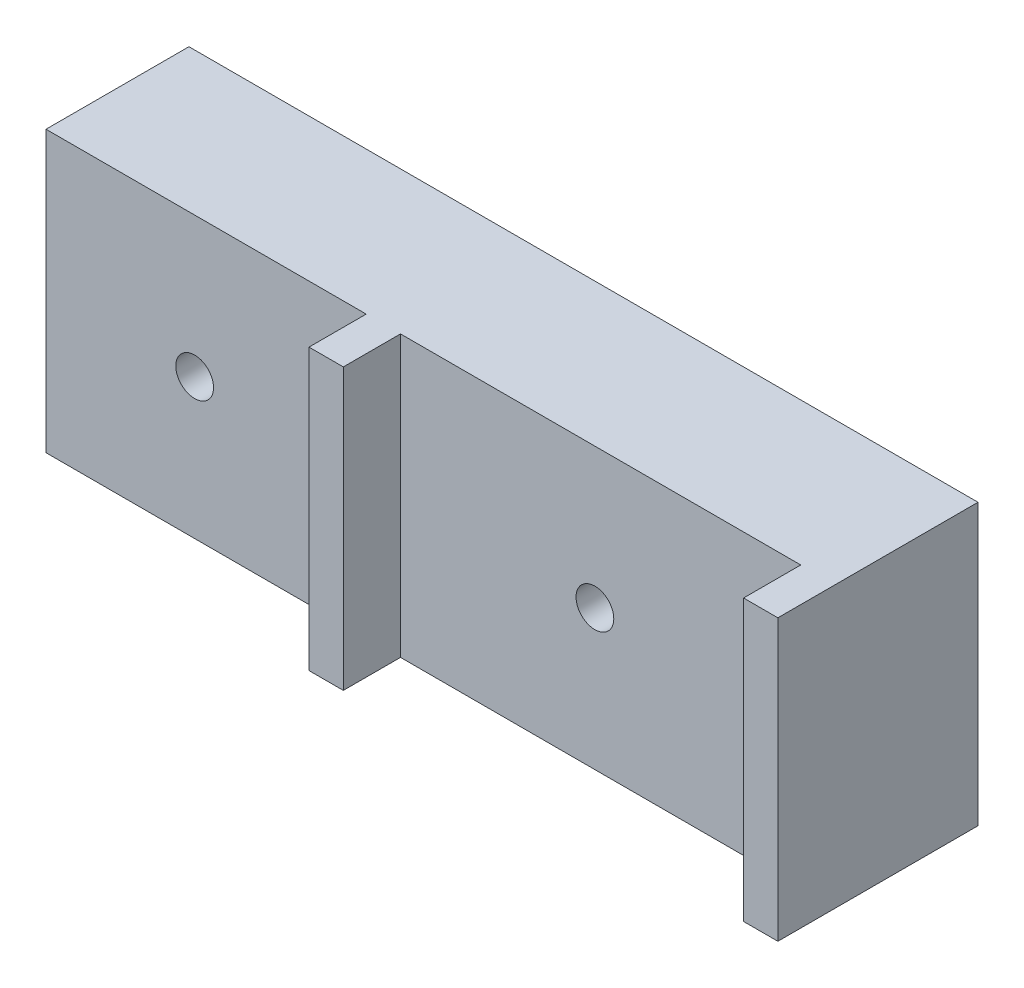
from build123d import *

# Parameters (mm, degrees)
SKETCH2_W      = 69
SKETCH2_H      = 24.5
EXTRUDE1_DEPTH = 12.5
SKETCH3_R      = 1.65
EXTRUDE2_DEPTH = 39.685430074
SKETCH4_W      = 3
SKETCH4_H      = 24.5
EXTRUDE3_DEPTH = 5


with BuildPart() as part:
    # Sketch2 → Extrude1 (new body)
    with BuildSketch(Plane.XY):
        Rectangle(SKETCH2_W, SKETCH2_H)
    extrude(amount=EXTRUDE1_DEPTH)

    # Sketch3 → Extrude2 (cut, through all)
    with BuildSketch(Plane.XY.offset(12.5)):
        with Locations((-21.5, 0)):
            Circle(SKETCH3_R)
        with Locations((13.5, 0)):
            Circle(SKETCH3_R)
    extrude(amount=-EXTRUDE2_DEPTH, mode=Mode.SUBTRACT)

    # Sketch4 → Extrude3 (add)
    with BuildSketch(Plane.XY.offset(12.5)):
        with Locations((33, 0)):
            Rectangle(SKETCH4_W, SKETCH4_H)
        with Locations((-5, 0)):
            Rectangle(SKETCH4_W, SKETCH4_H)
    extrude(amount=EXTRUDE3_DEPTH)


solid = part.part
